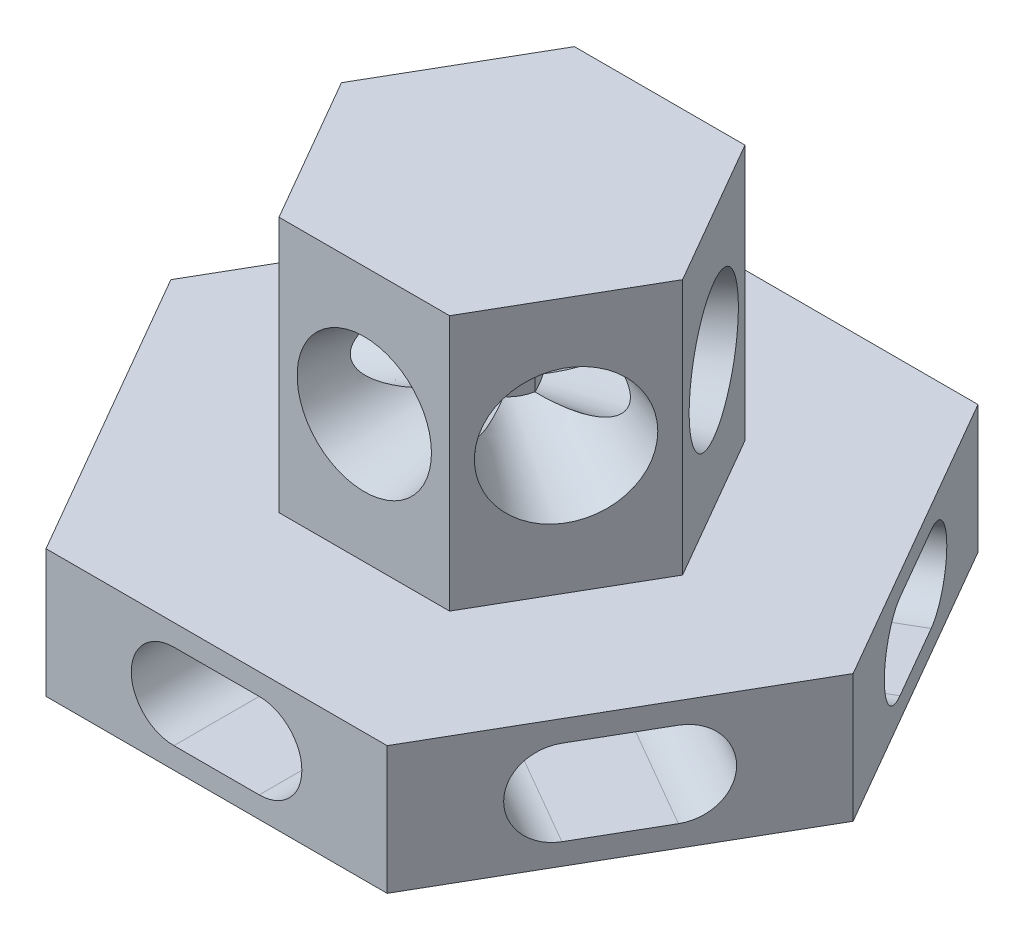
from build123d import *

# Parameters (mm, degrees)
BOSS_EXTRUDE1_DEPTH         = 30
BOSS_EXTRUDE3_DEPTH         = 60
SKETCH8_R                   = 15.75
CUT_EXTRUDE3_DEPTH          = 30
CUT_EXTRUDE3_DRAFT          = -10
CIRPATTERN4_COPY_1_SKETCH_R = 15.75
CIRPATTERN4_COPY_1_DEPTH    = 30
CIRPATTERN4_COPY_1_DRAFT    = -10
CIRPATTERN4_COPY_2_SKETCH_R = 15.75
CIRPATTERN4_COPY_2_DEPTH    = 30
CIRPATTERN4_COPY_2_DRAFT    = -10
CIRPATTERN4_COPY_3_SKETCH_R = 15.75
CIRPATTERN4_COPY_3_DEPTH    = 30
CIRPATTERN4_COPY_3_DRAFT    = -10
CIRPATTERN4_COPY_4_SKETCH_R = 15.75
CIRPATTERN4_COPY_4_DEPTH    = 30
CIRPATTERN4_COPY_4_DRAFT    = -10
CIRPATTERN4_COPY_5_SKETCH_R = 15.75
CIRPATTERN4_COPY_5_DEPTH    = 30
CIRPATTERN4_COPY_5_DRAFT    = -10
CUT_EXTRUDE4_DEPTH          = 44
CIRPATTERN6_COUNT           = 6


with BuildPart() as part:
    # Sketch1 → Boss-Extrude1 (new body)
    with BuildSketch(Plane(origin=(0, 0, 0), x_dir=(1, 0, 0), z_dir=(0, 1, 0))):
        Polygon((40, -69.282032303), (80, 0), (40, 69.282032303), (-40, 69.282032303), (-80, 0), (-40, -69.282032303), align=None)
    extrude(amount=BOSS_EXTRUDE1_DEPTH)

    # Sketch2 → Boss-Extrude3 (add)
    with BuildSketch(Plane(origin=(0, 30, 0), x_dir=(1, 0, 0), z_dir=(0, 1, 0))):
        Polygon((20, -34.641016151), (40, 0), (20, 34.641016151), (-20, 34.641016151), (-40, 0), (-20, -34.641016151), align=None)
    extrude(amount=BOSS_EXTRUDE3_DEPTH)


with BuildPart() as cut_extrude3_tool:
    # Sketch8 → Cut-Extrude3 (with draft: the straight prism first)
    with BuildSketch(Plane(origin=(30, 0, 17.320508076), x_dir=(0.5000000000000001, 0, -0.8660254037844386), z_dir=(0.8660254037844386, 0, 0.5000000000000001))):
        with Locations((0, 60)):
            Circle(SKETCH8_R)
    extrude(amount=-CUT_EXTRUDE3_DEPTH)
    # Cut-Extrude3: the draft: its side faces are tilted about the plane it starts from
    cut_extrude3_sides = [cut_extrude3_tool.faces().sort_by_distance(p)[0] for p in [
        (9.134618943, 60, 23.460408185),
    ]]
    draft(cut_extrude3_sides, Plane(origin=(30, 0, 17.320508076), x_dir=(0.5000000000000001, 0, -0.8660254037844386), z_dir=(0.8660254037844386, 0, 0.5000000000000001)), CUT_EXTRUDE3_DRAFT)


with BuildPart() as part_1:
    add(part.part)

    # Cut-Extrude3: cut by cut_extrude3_tool
    add(cut_extrude3_tool.part, mode=Mode.SUBTRACT)


with BuildPart() as cirpattern4_copy_1_tool:
    # CirPattern4 copy 1 sketch → CirPattern4 copy 1 (with draft: the straight prism first)
    with BuildSketch(Plane(origin=(30, 0, -17.320508076), x_dir=(-0.4999999999999998, 0, -0.8660254037844388), z_dir=(0.8660254037844388, 0, -0.4999999999999998))):
        with Locations((0, 60)):
            Circle(CIRPATTERN4_COPY_1_SKETCH_R)
    extrude(amount=-CIRPATTERN4_COPY_1_DEPTH)
    # CirPattern4 copy 1: the draft: its side faces are tilted about the plane it starts from
    cirpattern4_copy_1_sides = [cirpattern4_copy_1_tool.faces().sort_by_distance(p)[0] for p in [
        (24.884618943, 60, 3.819392034),
    ]]
    draft(cirpattern4_copy_1_sides, Plane(origin=(30, 0, -17.320508076), x_dir=(-0.4999999999999998, 0, -0.8660254037844388), z_dir=(0.8660254037844388, 0, -0.4999999999999998)), CIRPATTERN4_COPY_1_DRAFT)


with BuildPart() as part_2:
    add(part_1.part)

    # CirPattern4 copy 1: cut by cirpattern4_copy_1_tool
    add(cirpattern4_copy_1_tool.part, mode=Mode.SUBTRACT)


with BuildPart() as cirpattern4_copy_2_tool:
    # CirPattern4 copy 2 sketch → CirPattern4 copy 2 (with draft: the straight prism first)
    with BuildSketch(Plane(origin=(0, 0, -34.641016151), x_dir=(-1, 0, 0), z_dir=(0, 0, -1))):
        with Locations((0, 60)):
            Circle(CIRPATTERN4_COPY_2_SKETCH_R)
    extrude(amount=-CIRPATTERN4_COPY_2_DEPTH)
    # CirPattern4 copy 2: the draft: its side faces are tilted about the plane it starts from
    cirpattern4_copy_2_sides = [cirpattern4_copy_2_tool.faces().sort_by_distance(p)[0] for p in [
        (15.75, 60, -19.641016151),
    ]]
    draft(cirpattern4_copy_2_sides, Plane(origin=(0, 0, -34.641016151), x_dir=(-1, 0, 0), z_dir=(0, 0, -1)), CIRPATTERN4_COPY_2_DRAFT)


with BuildPart() as part_3:
    add(part_2.part)

    # CirPattern4 copy 2: cut by cirpattern4_copy_2_tool
    add(cirpattern4_copy_2_tool.part, mode=Mode.SUBTRACT)


with BuildPart() as cirpattern4_copy_3_tool:
    # CirPattern4 copy 3 sketch → CirPattern4 copy 3 (with draft: the straight prism first)
    with BuildSketch(Plane(origin=(-30, 0, -17.320508076), x_dir=(-0.5000000000000002, 0, 0.8660254037844385), z_dir=(-0.8660254037844385, 0, -0.5000000000000002))):
        with Locations((0, 60)):
            Circle(CIRPATTERN4_COPY_3_SKETCH_R)
    extrude(amount=-CIRPATTERN4_COPY_3_DEPTH)
    # CirPattern4 copy 3: the draft: its side faces are tilted about the plane it starts from
    cirpattern4_copy_3_sides = [cirpattern4_copy_3_tool.faces().sort_by_distance(p)[0] for p in [
        (-9.134618943, 60, -23.460408185),
    ]]
    draft(cirpattern4_copy_3_sides, Plane(origin=(-30, 0, -17.320508076), x_dir=(-0.5000000000000002, 0, 0.8660254037844385), z_dir=(-0.8660254037844385, 0, -0.5000000000000002)), CIRPATTERN4_COPY_3_DRAFT)


with BuildPart() as part_4:
    add(part_3.part)

    # CirPattern4 copy 3: cut by cirpattern4_copy_3_tool
    add(cirpattern4_copy_3_tool.part, mode=Mode.SUBTRACT)


with BuildPart() as cirpattern4_copy_4_tool:
    # CirPattern4 copy 4 sketch → CirPattern4 copy 4 (with draft: the straight prism first)
    with BuildSketch(Plane(origin=(-30, 0, 17.320508076), x_dir=(0.4999999999999994, 0, 0.866025403784439), z_dir=(-0.866025403784439, 0, 0.4999999999999994))):
        with Locations((0, 60)):
            Circle(CIRPATTERN4_COPY_4_SKETCH_R)
    extrude(amount=-CIRPATTERN4_COPY_4_DEPTH)
    # CirPattern4 copy 4: the draft: its side faces are tilted about the plane it starts from
    cirpattern4_copy_4_sides = [cirpattern4_copy_4_tool.faces().sort_by_distance(p)[0] for p in [
        (-24.884618943, 60, -3.819392034),
    ]]
    draft(cirpattern4_copy_4_sides, Plane(origin=(-30, 0, 17.320508076), x_dir=(0.4999999999999994, 0, 0.866025403784439), z_dir=(-0.866025403784439, 0, 0.4999999999999994)), CIRPATTERN4_COPY_4_DRAFT)


with BuildPart() as part_5:
    add(part_4.part)

    # CirPattern4 copy 4: cut by cirpattern4_copy_4_tool
    add(cirpattern4_copy_4_tool.part, mode=Mode.SUBTRACT)


with BuildPart() as cirpattern4_copy_5_tool:
    # CirPattern4 copy 5 sketch → CirPattern4 copy 5 (with draft: the straight prism first)
    with BuildSketch(Plane.XY.offset(34.641016151)):
        with Locations((0, 60)):
            Circle(CIRPATTERN4_COPY_5_SKETCH_R)
    extrude(amount=-CIRPATTERN4_COPY_5_DEPTH)
    # CirPattern4 copy 5: the draft: its side faces are tilted about the plane it starts from
    cirpattern4_copy_5_sides = [cirpattern4_copy_5_tool.faces().sort_by_distance(p)[0] for p in [
        (-15.75, 60, 19.641016151),
    ]]
    draft(cirpattern4_copy_5_sides, Plane.XY.offset(34.641016151), CIRPATTERN4_COPY_5_DRAFT)


with BuildPart() as part_6:
    add(part_5.part)

    # CirPattern4 copy 5: cut by cirpattern4_copy_5_tool
    add(cirpattern4_copy_5_tool.part, mode=Mode.SUBTRACT)

    # Sketch3 → Cut-Extrude4 (cut)
    with BuildSketch(Plane(origin=(60, 0, 34.641016151), x_dir=(0.5000000000000001, 0, -0.8660254037844386), z_dir=(0.8660254037844386, 0, 0.5000000000000001))):
        with BuildLine():
            Line((-10, 25), (10, 25))
            ThreePointArc((10, 25), (20, 15), (10, 5))
            Line((10, 5), (-10, 5))
            ThreePointArc((-10, 5), (-20, 15), (-10, 25))
        make_face()
    cut_extrude4 = extrude(amount=-CUT_EXTRUDE4_DEPTH, mode=Mode.SUBTRACT)

    # CirPattern6: Cut-Extrude4 ×6 about axis
    cirpattern6_axis = Axis((0, -4.5, 0), (0, 1, 0))
    for i in range(1, CIRPATTERN6_COUNT):
        add(cut_extrude4.rotate(cirpattern6_axis, i * 360 / CIRPATTERN6_COUNT), mode=Mode.SUBTRACT)


solid = part_6.part
